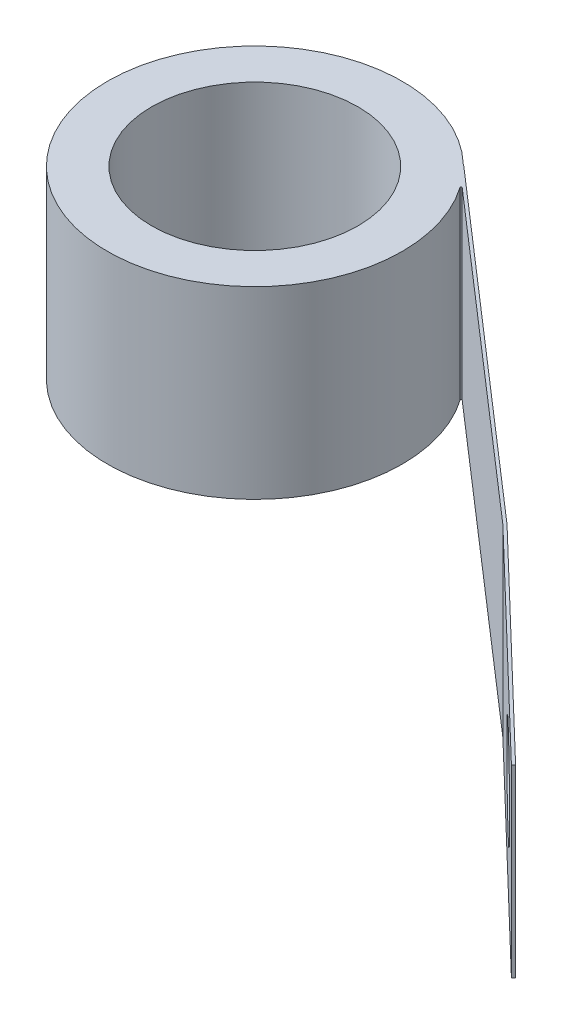
from build123d import *

# Parameters (mm, degrees)
SKETCH1_R           = 3.556
BOSS_EXTRUDE1_DEPTH = 6.35
SKETCH2_R           = 1.651
CUT_EXTRUDE1_DEPTH  = 6.35
FILLET1_R           = 0.0254


with BuildPart() as part:
    # Sketch1 → Boss-Extrude1 (new body)
    with BuildSketch(Plane(origin=(0, 0, 0), x_dir=(1, 0, 0), z_dir=(0, 1, 0))):
        with BuildLine():
            Line((22.365139772, -13.37924688), (15.035220761, -6.343773385))
            Line((15.035220761, -6.343773385), (3.521977792, 3.669378045))
            Line((3.521977792, 3.669378045), (3.517736747, 3.664959506))
            ThreePointArc((3.517736747, 3.664959506), (-3.784384399, -3.388928255), (4.029432062, 3.093554146))
            Line((4.029432062, 3.093554146), (14.964866026, -6.417072576))
            Line((14.964866026, -6.417072576), (22.294785037, -13.45254607))
            Line((22.294785037, -13.45254607), (22.365139772, -13.37924688))
        make_face()
        with Locations(Location((0, 0, 0), (0, 0, 270))):
            Circle(SKETCH1_R, mode=Mode.SUBTRACT)
    extrude(amount=BOSS_EXTRUDE1_DEPTH)

    # Sketch2 → Cut-Extrude1 (cut)
    with BuildSketch(Plane(origin=(3.305454811, 0, -4.914803593), x_dir=(-0.7214487215857361, 0, -0.6924678636025697), z_dir=(0.6924678636025697, 0, -0.7214487215857361))):
        with Locations((-22.608627396, 3.175)):
            Circle(SKETCH2_R)
    extrude(amount=-CUT_EXTRUDE1_DEPTH, mode=Mode.SUBTRACT)

    # Fillet1
    fillet1_edges = [part.edges().sort_by_distance(p)[0] for p in [
        (4.029432062, 3.175, -3.093554146),
    ]]
    fillet(fillet1_edges, radius=FILLET1_R)


solid = part.part
